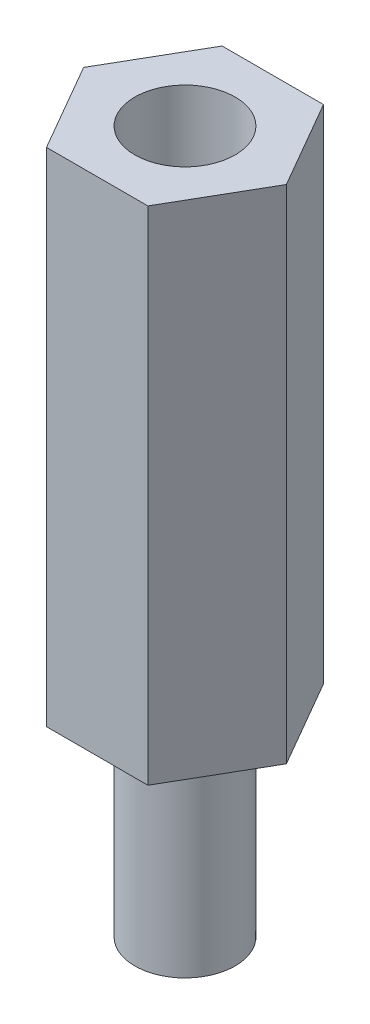
from build123d import *

# Parameters (mm, degrees)
SKETCH_1_R      = 2
EXTRUDE_1_DEPTH = 20
SKETCH_2_R      = 2
EXTRUDE_2_DEPTH = 8


with BuildPart() as part:
    # 草图1 → 凸台-拉伸1 (new body)
    with BuildSketch(Plane(origin=(0, 0, 0), x_dir=(1, 0, 0), z_dir=(0, 1, 0))):
        Polygon((4.041451884, 0), (2.020725942, 3.5), (-2.020725942, 3.5), (-4.041451884, 0), (-2.020725942, -3.5), (2.020725942, -3.5), align=None)
        with Locations(Location((0, 0, 0), (0, 0, 270))):
            Circle(SKETCH_1_R, mode=Mode.SUBTRACT)
    extrude(amount=EXTRUDE_1_DEPTH)


with BuildPart() as body_2:
    # 草图2 → 凸台-拉伸2 (new body)
    with BuildSketch(Plane.XZ):
        with Locations(Location((0, 0, 0), (0, 0, 270))):
            Circle(SKETCH_2_R)
    extrude(amount=EXTRUDE_2_DEPTH)


solid = Compound([part.part, body_2.part])
